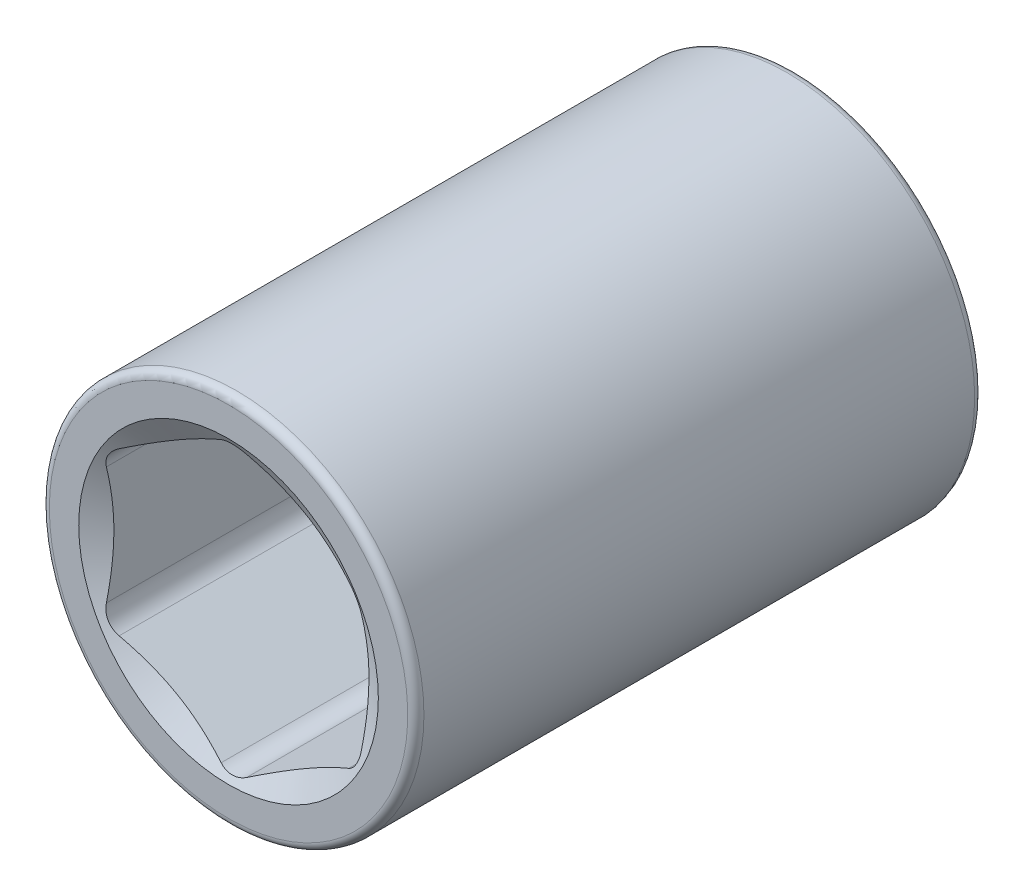
from build123d import *

# Parameters (mm, degrees)
SKETCH4_W          = 22.225
SKETCH4_H          = 7.3421875
CUT_EXTRUDE1_DEPTH = 9.128125
CUT_EXTRUDE3_START = -4.7625
SKETCH7_R          = 4
CUT_EXTRUDE3_DEPTH = 4.7625
SKETCH9_W          = 6.35
SKETCH9_H          = 6.35
CUT_EXTRUDE5_DEPTH = 8.334375
FILLET1_R          = 0.3175


with BuildPart() as part:
    # Sketch4 → Revolve1 (revolve)
    with BuildSketch(Plane(origin=(0, 0, 0), x_dir=(0, 0, -1), z_dir=(1, 0, 0)), mode=Mode.PRIVATE) as revolve1_sk:
        with Locations((0, 3.67109375)):
            Rectangle(SKETCH4_W, SKETCH4_H)
    revolve(revolve1_sk.sketch.rotate(Axis((0, 0, 11.1125), (0, 0, -1)), 90), axis=Axis((0, 0, 11.1125), (0, 0, -1)))

    # Sketch5 → Cut-Extrude1 (cut)
    with BuildSketch(Plane.XY.offset(11.1125)):
        with BuildLine():
            Line((-5, 2.309401077), (-5, -2.309401077))
            ThreePointArc((-5, -2.309401077), (-4.866025404, -2.809401077), (-4.5, -3.175426481))
            Line((-4.5, -3.175426481), (-0.5, -5.484827557))
            ThreePointArc((-0.5, -5.484827557), (0, -5.618802154), (0.5, -5.484827557))
            Line((0.5, -5.484827557), (4.5, -3.175426481))
            ThreePointArc((4.5, -3.175426481), (4.866025404, -2.809401077), (5, -2.309401077))
            Line((5, -2.309401077), (5, 2.309401077))
            ThreePointArc((5, 2.309401077), (4.866025404, 2.809401077), (4.5, 3.175426481))
            Line((4.5, 3.175426481), (0.5, 5.484827557))
            ThreePointArc((0.5, 5.484827557), (0, 5.618802154), (-0.5, 5.484827557))
            Line((-0.5, 5.484827557), (-4.5, 3.175426481))
            ThreePointArc((-4.5, 3.175426481), (-4.866025404, 2.809401077), (-5, 2.309401077))
        make_face()
    extrude(amount=-CUT_EXTRUDE1_DEPTH, mode=Mode.SUBTRACT)

    # Sketch7 → Cut-Extrude3 (cut)
    with BuildSketch(Plane.XY.offset(1.984375).offset(CUT_EXTRUDE3_START)):
        Circle(SKETCH7_R)
    extrude(amount=CUT_EXTRUDE3_DEPTH, mode=Mode.SUBTRACT)

    # Sketch9 → Cut-Extrude5 (cut)
    with BuildSketch(Plane(origin=(0, 0, -11.1125), x_dir=(-1, 0, 0), z_dir=(0, 0, -1))):
        Rectangle(SKETCH9_W, SKETCH9_H)
    extrude(amount=-CUT_EXTRUDE5_DEPTH, mode=Mode.SUBTRACT)

    # Cut-Extrude6 cone 1 section (through the dimple's axis) → Cut-Extrude6 (revolve, cut)
    with BuildSketch(Plane(origin=(0, 0, -11.1125), x_dir=(0, 1, 0), z_dir=(1, 0, 0))):
        Polygon((0, 0), (4.744128061, 0), (0, 2.739023613), align=None)
    revolve(axis=Axis((0, 0, -11.1125), (0, 0, 1)), mode=Mode.SUBTRACT)

    # Fillet1
    fillet1_edges = [part.edges().sort_by_distance(p)[0] for p in [
        (-7.3421875, 0, -11.1125),
        (-7.3421875, 0, 11.1125),
    ]]
    fillet(fillet1_edges, radius=FILLET1_R)

    # Cut-Extrude9 cone 1 section (through the dimple's axis) → Cut-Extrude9 (revolve, cut)
    with BuildSketch(Plane(origin=(0, 0, 11.1125), x_dir=(0, -1, 0), z_dir=(1, 0, 0))):
        Polygon((0, 0), (5.872802154, 0), (0, 3.390663904), align=None)
    revolve(axis=Axis((0, 0, 11.1125), (0, 0, -1)), mode=Mode.SUBTRACT)


solid = part.part
